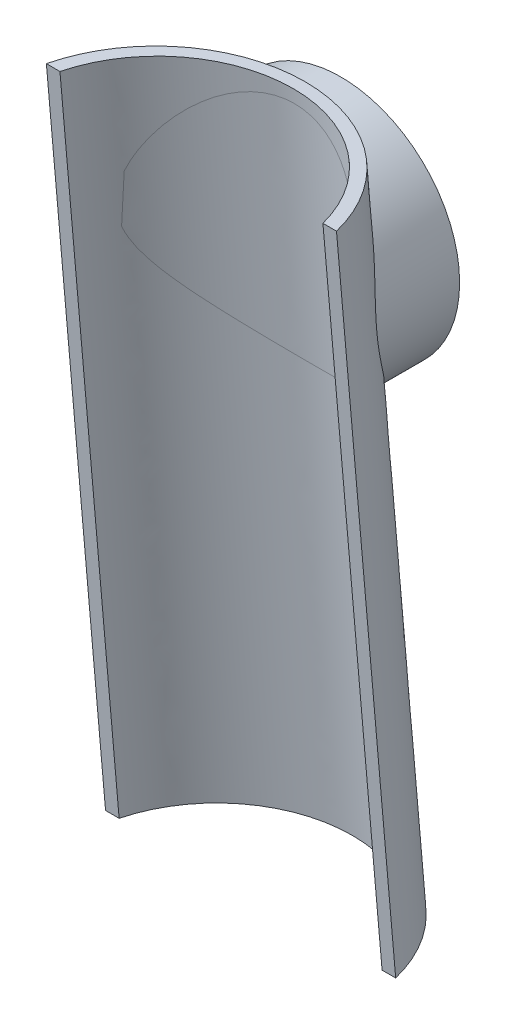
from build123d import *

# Parameters (mm, degrees)
SKETCH1_R           = 17.5
BOSS_EXTRUDE1_DEPTH = 15
CUT_EXTRUDE1_DEPTH  = 2
SKETCH9_R           = 20
CUT_EXTRUDE2_DEPTH  = 100.381983754


with BuildPart() as part:
    # Sketch1 → Boss-Extrude1 (new body)
    with BuildSketch(Plane.XY):
        Circle(SKETCH1_R)
    extrude(amount=BOSS_EXTRUDE1_DEPTH)

    # Sketch2 → Cut-Extrude1 (cut)
    with BuildSketch(Plane(origin=(0, 0, 0), x_dir=(-1, 0, 0), z_dir=(0, 0, -1))):
        with BuildLine():
            Line((3, 1.802775638), (3, 16.1))
            Line((3, 16.1), (-3, 16.1))
            Line((-3, 16.1), (-3, 1.802775638))
            ThreePointArc((-3, 1.802775638), (-3.5, 0), (-3, -1.802775638))
            Line((-3, -1.802775638), (-3, -16.1))
            Line((-3, -16.1), (3, -16.1))
            Line((3, -16.1), (3, -1.802775638))
            ThreePointArc((3, -1.802775638), (3.5, 0), (3, 1.802775638))
        make_face()
    extrude(amount=-CUT_EXTRUDE1_DEPTH, mode=Mode.SUBTRACT)

    # Sweep1: sweep along a path in Sketch8
    with BuildLine(Plane(origin=(0, 0, 0), x_dir=(0, 0, -1), z_dir=(1, 0, 0))) as sweep1_path:
        Line((-5.24788844, 19.5), (3.467685835, -80.119469809))
    # Sketch5 → Sweep1 (sweep)
    with BuildSketch(Plane(origin=(0, 19.5, 0), x_dir=(1, 0, 0), z_dir=(0, 1, 0))):
        with BuildLine():
            Line((-21.364916731, -22), (-19.364916731, -22))
            ThreePointArc((-19.364916731, -22), (0, -7), (19.364916731, -22))
            Line((19.364916731, -22), (21.364916731, -22))
            ThreePointArc((21.364916731, -22), (0, -5.24788844), (-21.364916731, -22))
        make_face()
    sweep(path=sweep1_path.line)

    # Sketch9 → Cut-Extrude2 (cut, along a direction that is not the sketch's normal)
    with BuildSketch(Plane(origin=(0, 19.5, 0), x_dir=(1, 0, 0), z_dir=(0, 1, 0))):
        with Locations((0, -27)):
            Circle(SKETCH9_R)
    extrude(amount=-CUT_EXTRUDE2_DEPTH, dir=(0, 0.9961946980917461, 0.08715574274765157), mode=Mode.SUBTRACT)


solid = part.part
